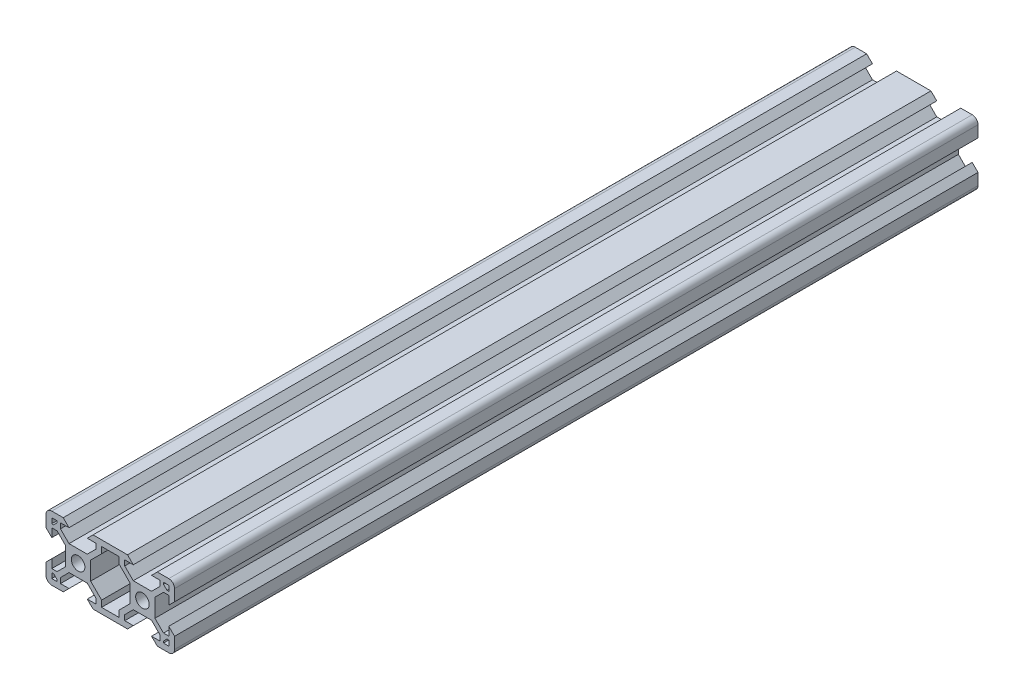
from build123d import *

# Parameters (mm, degrees)
ESQUISSE1_R        = 2.1
BOSS_EXTRU_1_DEPTH = 125


with BuildPart() as part:
    # Esquisse1 → Boss.-Extru.1 (new, symmetric)
    with BuildSketch(Plane.XY):
        with BuildLine():
            Line((-10, 3.900660172), (-12.84, 3.900660172))
            Line((-12.84, 3.900660172), (-15.499339828, 6.56))
            Line((-15.499339828, 6.56), (-15.499339828, 8.2))
            Line((-15.499339828, 8.2), (-12.84, 8.2))
            Line((-12.84, 8.2), (-14.64, 10))
            Line((-14.64, 10), (-18.2, 10))
            ThreePointArc((-18.2, 10), (-19.472792206, 9.472792206), (-20, 8.2))
            Line((-20, 8.2), (-20, 4.64))
            Line((-20, 4.64), (-18.2, 2.84))
            Line((-18.2, 2.84), (-18.2, 5.499339828))
            Line((-18.2, 5.499339828), (-16.56, 5.499339828))
            Line((-16.56, 5.499339828), (-13.900660172, 2.84))
            Line((-13.900660172, 2.84), (-13.900660172, 0))
            Line((-13.900660172, 0), (-13.900660172, -2.84))
            Line((-13.900660172, -2.84), (-16.56, -5.499339828))
            Line((-16.56, -5.499339828), (-18.2, -5.499339828))
            Line((-18.2, -5.499339828), (-18.2, -2.84))
            Line((-18.2, -2.84), (-20, -4.64))
            Line((-20, -4.64), (-20, -8.2))
            ThreePointArc((-20, -8.2), (-19.472792206, -9.472792206), (-18.2, -10))
            Line((-18.2, -10), (-14.64, -10))
            Line((-14.64, -10), (-12.84, -8.2))
            Line((-12.84, -8.2), (-15.499339828, -8.2))
            Line((-15.499339828, -8.2), (-15.499339828, -6.56))
            Line((-15.499339828, -6.56), (-12.84, -3.900660172))
            Line((-12.84, -3.900660172), (-10, -3.900660172))
            Line((-10, -3.900660172), (-7.16, -3.900660172))
            Line((-7.16, -3.900660172), (-4.500660172, -6.56))
            Line((-4.500660172, -6.56), (-4.500660172, -8.2))
            Line((-4.500660172, -8.2), (-7.16, -8.2))
            Line((-7.16, -8.2), (-5.36, -10))
            Line((-5.36, -10), (5.36, -10))
            Line((5.36, -10), (7.16, -8.2))
            Line((7.16, -8.2), (4.500660172, -8.2))
            Line((4.500660172, -8.2), (4.500660172, -6.56))
            Line((4.500660172, -6.56), (7.16, -3.900660172))
            Line((7.16, -3.900660172), (10, -3.900660172))
            Line((10, -3.900660172), (12.84, -3.900660172))
            Line((12.84, -3.900660172), (15.499339828, -6.56))
            Line((15.499339828, -6.56), (15.499339828, -8.2))
            Line((15.499339828, -8.2), (12.84, -8.2))
            Line((12.84, -8.2), (14.64, -10))
            Line((14.64, -10), (18.2, -10))
            ThreePointArc((18.2, -10), (19.472792206, -9.472792206), (20, -8.2))
            Line((20, -8.2), (20, -4.64))
            Line((20, -4.64), (18.2, -2.84))
            Line((18.2, -2.84), (18.2, -5.499339828))
            Line((18.2, -5.499339828), (16.56, -5.499339828))
            Line((16.56, -5.499339828), (13.900660172, -2.84))
            Line((13.900660172, -2.84), (13.900660172, 0))
            Line((13.900660172, 0), (13.900660172, 2.84))
            Line((13.900660172, 2.84), (16.56, 5.499339828))
            Line((16.56, 5.499339828), (18.2, 5.499339828))
            Line((18.2, 5.499339828), (18.2, 2.84))
            Line((18.2, 2.84), (20, 4.64))
            Line((20, 4.64), (20, 8.2))
            ThreePointArc((20, 8.2), (19.472792206, 9.472792206), (18.2, 10))
            Line((18.2, 10), (14.64, 10))
            Line((14.64, 10), (12.84, 8.2))
            Line((12.84, 8.2), (15.499339828, 8.2))
            Line((15.499339828, 8.2), (15.499339828, 6.56))
            Line((15.499339828, 6.56), (12.84, 3.900660172))
            Line((12.84, 3.900660172), (10, 3.900660172))
            Line((10, 3.900660172), (7.16, 3.900660172))
            Line((7.16, 3.900660172), (4.500660172, 6.56))
            Line((4.500660172, 6.56), (4.500660172, 8.2))
            Line((4.500660172, 8.2), (7.16, 8.2))
            Line((7.16, 8.2), (5.36, 10))
            Line((5.36, 10), (-5.36, 10))
            Line((-5.36, 10), (-7.16, 8.2))
            Line((-7.16, 8.2), (-4.500660172, 8.2))
            Line((-4.500660172, 8.2), (-4.500660172, 6.56))
            Line((-4.500660172, 6.56), (-7.16, 3.900660172))
            Line((-7.16, 3.900660172), (-10, 3.900660172))
        make_face()
        with Locations((-10, 0)):
            Circle(ESQUISSE1_R, mode=Mode.SUBTRACT)
        with Locations(Location((10, 0, 0), (0, 0, 180))):
            Circle(ESQUISSE1_R, mode=Mode.SUBTRACT)
        Polygon((-2.7, 8.2), (-2.7, 6.239339828), (-6.099339828, 2.84), (-6.099339828, -2.84), (-2.7, -6.239339828), (-2.7, -8.2), (2.7, -8.2), (2.7, -6.239339828), (6.099339828, -2.84), (6.099339828, 2.84), (2.7, 6.239339828), (2.7, 8.2), align=None, mode=Mode.SUBTRACT)
        Polygon((-18.2, 8.2), (-18.2, 6.569339828), (-17.63, 6.569339828), (-16.569339828, 7.63), (-16.569339828, 8.2), align=None, mode=Mode.SUBTRACT)
        Polygon((-18.2, -6.569339828), (-17.63, -6.569339828), (-16.569339828, -7.63), (-16.569339828, -8.2), (-18.2, -8.2), align=None, mode=Mode.SUBTRACT)
        Polygon((18.2, 6.569339828), (17.63, 6.569339828), (16.569339828, 7.63), (16.569339828, 8.2), (18.2, 8.2), align=None, mode=Mode.SUBTRACT)
        Polygon((18.2, -6.569339828), (17.63, -6.569339828), (16.569339828, -7.63), (16.569339828, -8.2), (18.2, -8.2), align=None, mode=Mode.SUBTRACT)
    extrude(amount=BOSS_EXTRU_1_DEPTH, both=True)


solid = part.part
